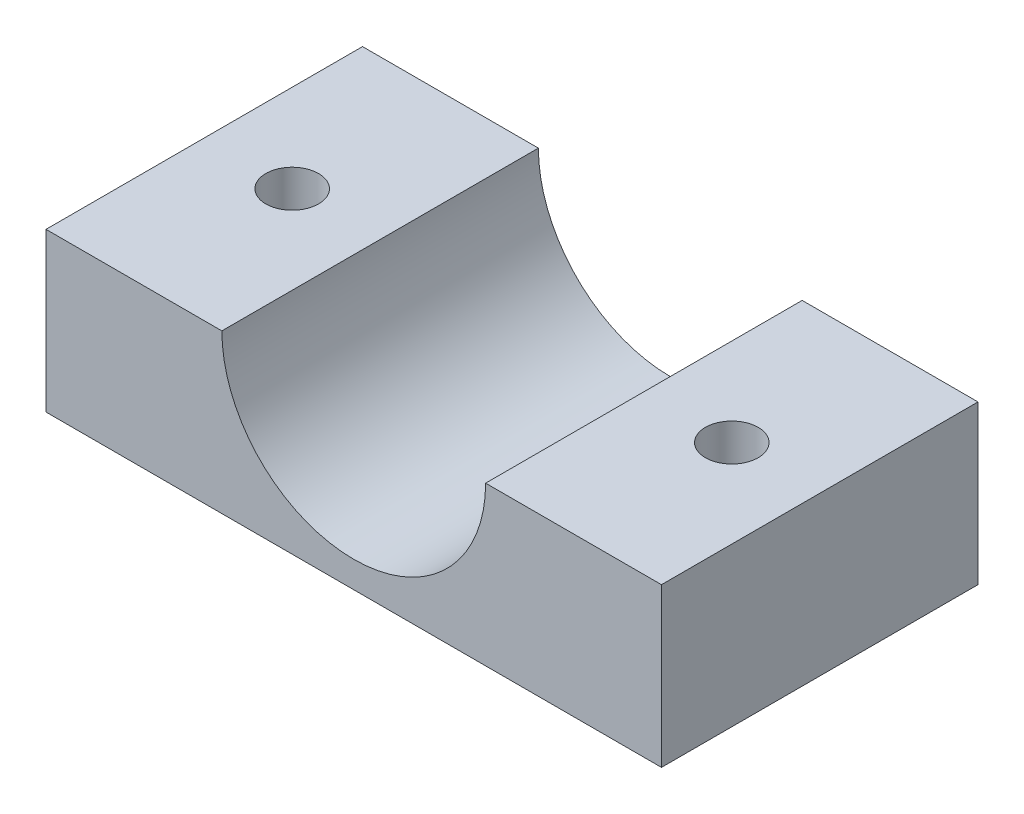
from build123d import *

# Parameters (mm, degrees)
SKETCH1_W           = 35
SKETCH1_H           = 18
SKETCH1_R           = 1.5
BOSS_EXTRUDE1_DEPTH = 9
CUT_EXTRUDE1_REACH  = 28.669
SKETCH2_R           = 7.5


with BuildPart() as part:
    # Sketch1 → Boss-Extrude1 (new body)
    with BuildSketch(Plane(origin=(0, 0, 0), x_dir=(1, 0, 0), z_dir=(0, 1, 0))):
        Rectangle(SKETCH1_W, SKETCH1_H)
        with Locations(Location((-12.5, 0, 0), (0, 0, 270))):
            Circle(SKETCH1_R, mode=Mode.SUBTRACT)
        with Locations(Location((12.5, 0, 0), (0, 0, 90))):
            Circle(SKETCH1_R, mode=Mode.SUBTRACT)
    extrude(amount=BOSS_EXTRUDE1_DEPTH)

    # Sketch2 → Cut-Extrude1 (cut, up to next)
    with BuildSketch(Plane.XY.offset(9), mode=Mode.PRIVATE) as cut_extrude1_sk1:
        with Locations((0, 9)):
            Circle(SKETCH2_R)
    cut_extrude1_tool1 = extrude(cut_extrude1_sk1.sketch, amount=-CUT_EXTRUDE1_REACH, mode=Mode.PRIVATE) & part.part
    add(cut_extrude1_tool1.solids().sort_by_distance((0, 9, 9))[0], mode=Mode.SUBTRACT)


solid = part.part
